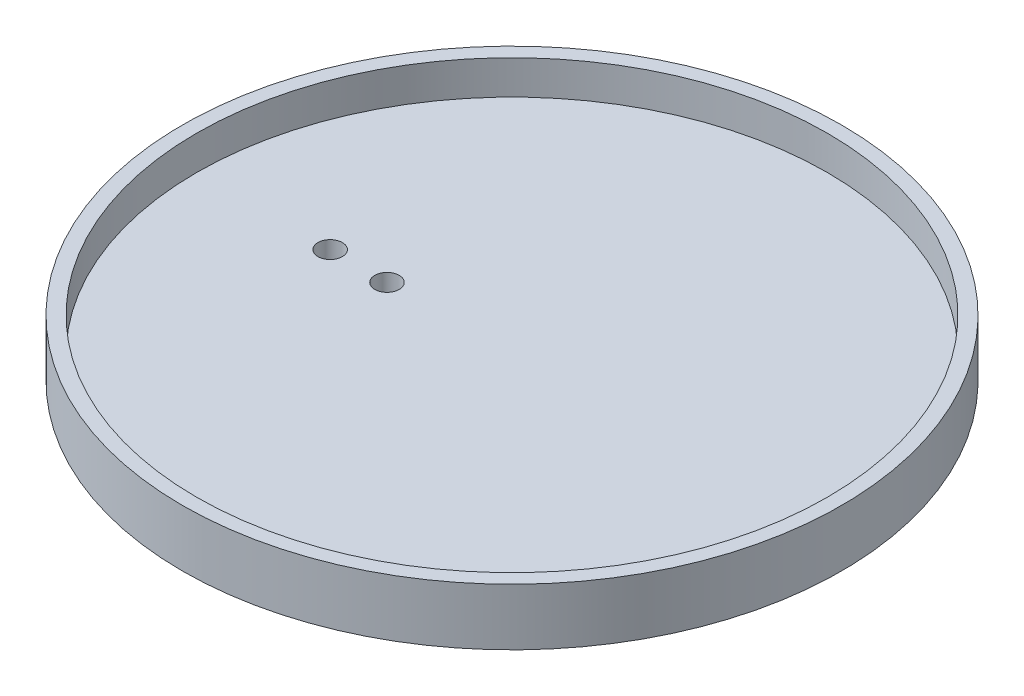
from build123d import *

# Parameters (mm, degrees)
SKETCH_1_R                       = 58
CUP_PLATE_D116_T4_DEPTH          = 4
SKETCH_2_R                       = 58
SKETCH_2_R_2                     = 55.5
DRIP_SKIRT_OD116_ID111_H10_DEPTH = 10
SKETCH_3_R                       = 2.15
M4_MOVING_MOUNT_CLEARANCE_DEPTH  = 4


with BuildPart() as part:
    # 草图1 → Cup_plate_D116_T4 (new body)
    with BuildSketch(Plane(origin=(0, 0, 0), x_dir=(1, 0, 0), z_dir=(0, 1, 0))):
        with Locations(Location((0, 0, 0), (0, 0, 270))):
            Circle(SKETCH_1_R)
    extrude(amount=CUP_PLATE_D116_T4_DEPTH)

    # 草图2 → Drip_skirt_OD116_ID111_H10 (add)
    with BuildSketch(Plane(origin=(0, 0, 0), x_dir=(1, 0, 0), z_dir=(0, 1, 0))):
        with Locations(Location((0, 0, 0), (0, 0, 270))):
            Circle(SKETCH_2_R)
        with Locations(Location((0, 0, 0), (0, 0, 270))):
            Circle(SKETCH_2_R_2, mode=Mode.SUBTRACT)
    extrude(amount=DRIP_SKIRT_OD116_ID111_H10_DEPTH)

    # 草图3 → M4_moving_mount_clearance (cut)
    with BuildSketch(Plane(origin=(0, 0, 0), x_dir=(1, 0, 0), z_dir=(0, 1, 0))):
        with Locations(Location((-22, 0, 0), (0, 0, 270))):
            Circle(SKETCH_3_R)
        with Locations(Location((-32, 0, 0), (0, 0, 270))):
            Circle(SKETCH_3_R)
    extrude(amount=M4_MOVING_MOUNT_CLEARANCE_DEPTH, mode=Mode.SUBTRACT)


solid = part.part
